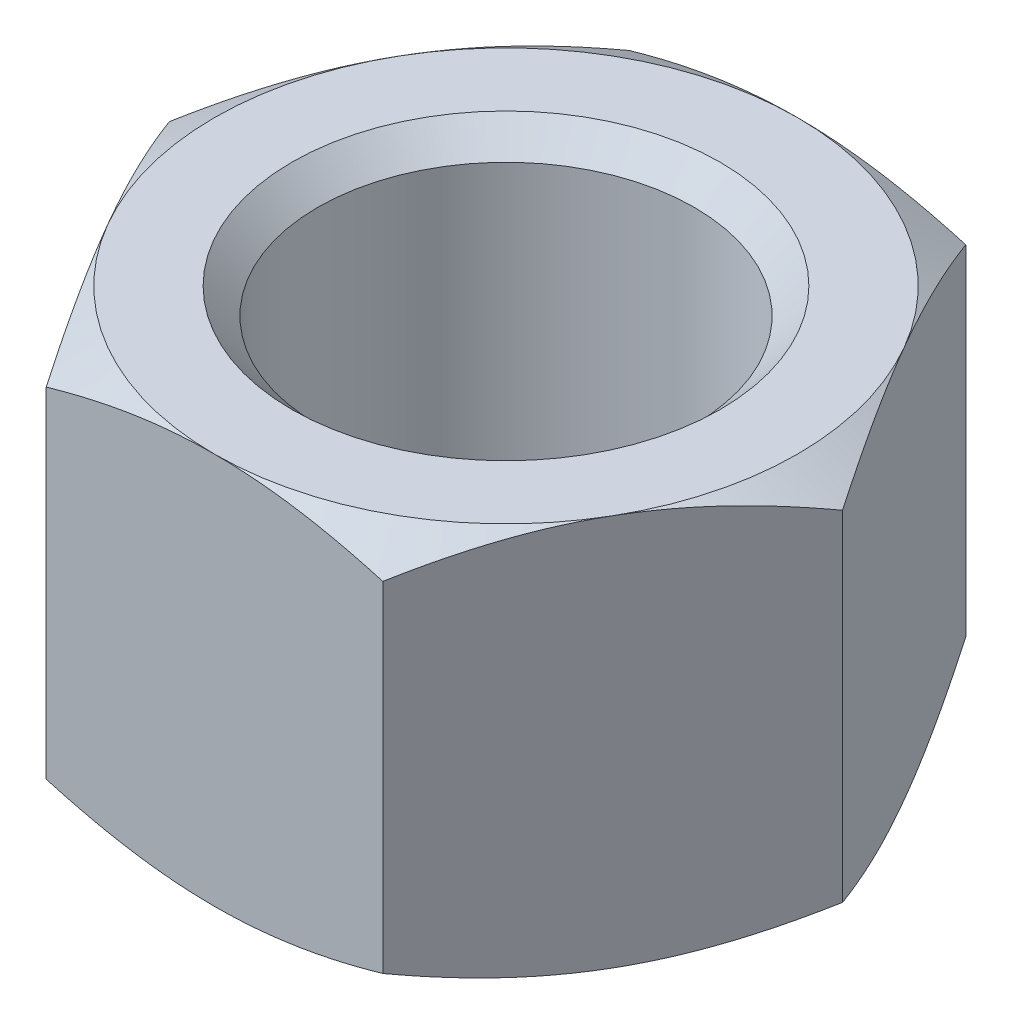
from build123d import *

# Parameters (mm, degrees)
EXTRUDE1_DEPTH  = 12.8
HOLE_WIZARD_D_D = 12.3


with BuildPart() as part:
    # Sketch1 → Extrude1 (new body)
    with BuildSketch(Plane(origin=(0, 0, 0), x_dir=(1, 0, 0), z_dir=(0, 1, 0))):
        Polygon((5.5, 9.526279442), (-5.5, 9.526279442), (-11, 0), (-5.5, -9.526279442), (5.5, -9.526279442), (11, 0), align=None)
    extrude(amount=EXTRUDE1_DEPTH)

    # d (through all)
    with Locations(Plane(origin=(0, 12.8, 0), x_dir=(-1, 0, 0), z_dir=(0, 1, 0))):
        with Locations((0, 0)):
            Hole(HOLE_WIZARD_D_D / 2)

    # Sketch5 → Cut-Revolve1 (revolve, cut)
    with BuildSketch(Plane(origin=(0, 0, 0), x_dir=(0, 0, -1), z_dir=(1, 0, 0))):
        Polygon((-9.526279442, 12.8), (-11.5, 11.660471904), (-11.5, 12.8), align=None)
        Polygon((-11.5, 0), (-9.526279442, 0), (-11.5, 1.139528096), align=None)
    revolve(axis=Axis((0, 0, 0), (0, 1, 0)), mode=Mode.SUBTRACT)

    # Sketch7 → Cut-Revolve2 (revolve, cut)
    with BuildSketch(Plane(origin=(0, 0, 0), x_dir=(0, 0, -1), z_dir=(1, 0, 0)), mode=Mode.PRIVATE) as cut_revolve2_sk:
        Polygon((-7, 12.8), (-6.15, 12.8), (-6.15, 11.95), align=None)
        Polygon((-6.15, 0.85), (-7, 0), (-6.15, 0), align=None)
    revolve(cut_revolve2_sk.sketch.rotate(Axis((0, 0, 0), (0, 1, 0)), 180), axis=Axis((0, 0, 0), (0, 1, 0)), mode=Mode.SUBTRACT)


solid = part.part
